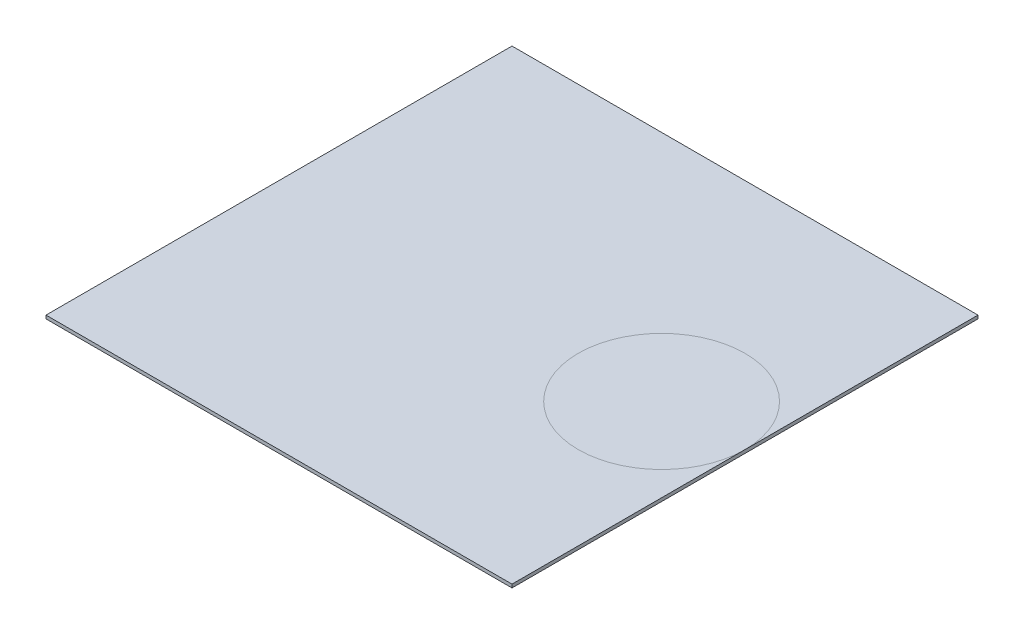
from build123d import *

# Parameters (mm, degrees)
SKETCH1_W           = 139.7
SKETCH1_H           = 139.7
BOSS_EXTRUDE1_DEPTH = 0.5


with BuildPart() as part:
    # Sketch1 → Boss-Extrude1 (new, symmetric)
    with BuildSketch(Plane(origin=(0, 0, 0), x_dir=(1, 0, 0), z_dir=(0, 1, 0))):
        Rectangle(SKETCH1_W, SKETCH1_H)
    extrude(amount=BOSS_EXTRUDE1_DEPTH, both=True)


solid = part.part
